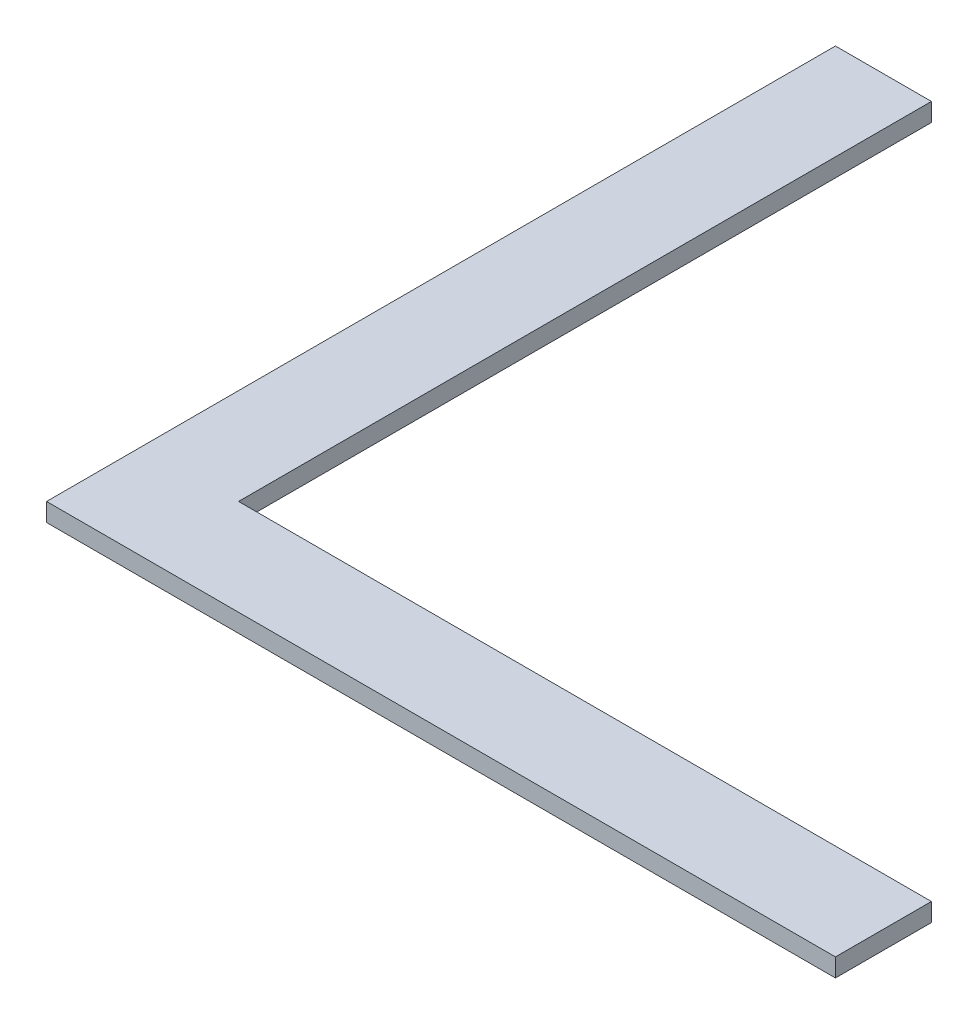
from build123d import *

# Parameters (mm, degrees)
BOSS_EXTRUDE1_DEPTH = 1


with BuildPart() as part:
    # Sketch1 → Boss-Extrude1 (new body)
    with BuildSketch(Plane(origin=(0, 0, 0), x_dir=(1, 0, 0), z_dir=(0, 1, 0))):
        Polygon((-5.25, 37.9), (-5.25, -5.25), (37.9, -5.25), (37.9, 0), (0, 0), (0, 37.9), align=None)
    extrude(amount=BOSS_EXTRUDE1_DEPTH)


solid = part.part
